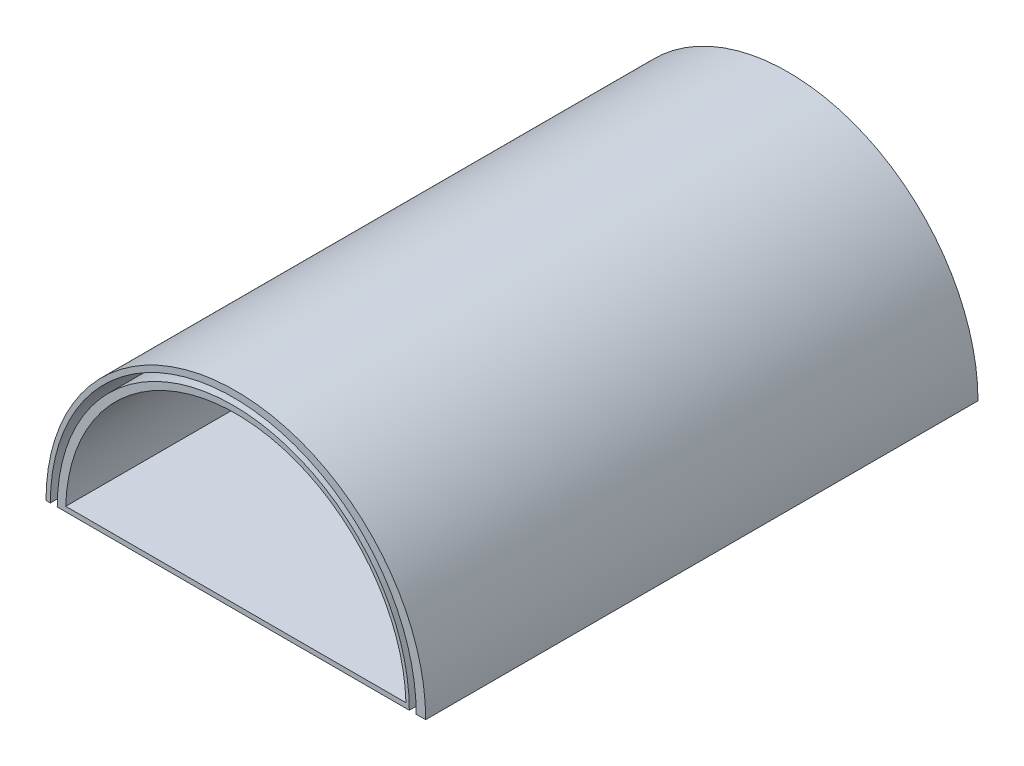
from build123d import *

# Parameters (mm, degrees)
BOSS_EXTRUDE1_DEPTH = 203.2
CUT_EXTRUDE1_DEPTH  = 201.422
CUT_EXTRUDE2_DEPTH  = 101.6


with BuildPart() as part:
    # Sketch2 → Boss-Extrude1 (new body)
    with BuildSketch(Plane.XY):
        with BuildLine():
            Line((-69.85, 0), (69.85, 0))
            ThreePointArc((69.85, 0), (0, 69.85), (-69.85, 0))
        make_face()
    extrude(amount=BOSS_EXTRUDE1_DEPTH)

    # Sketch3 → Cut-Extrude1 (cut)
    with BuildSketch(Plane.XY.offset(203.2)):
        with BuildLine():
            Line((-62.585749472, 1.778), (62.585749472, 1.778))
            ThreePointArc((62.585749472, 1.778), (0, 62.611), (-62.585749472, 1.778))
        make_face()
    extrude(amount=-CUT_EXTRUDE1_DEPTH, mode=Mode.SUBTRACT)

    # Sketch5 → Cut-Extrude2 (cut)
    with BuildSketch(Plane.XY.offset(203.2)):
        with BuildLine():
            Line((66.363298263, 0), (63.823298263, 0))
            ThreePointArc((63.823298263, 0), (-0.946701737, 64.77), (-65.716701737, 0))
            Line((-65.716701737, 0), (-68.256701737, 0))
            ThreePointArc((-68.256701737, 0), (-0.946701737, 67.31), (66.363298263, 0))
        make_face()
    extrude(amount=-CUT_EXTRUDE2_DEPTH, mode=Mode.SUBTRACT)


solid = part.part
